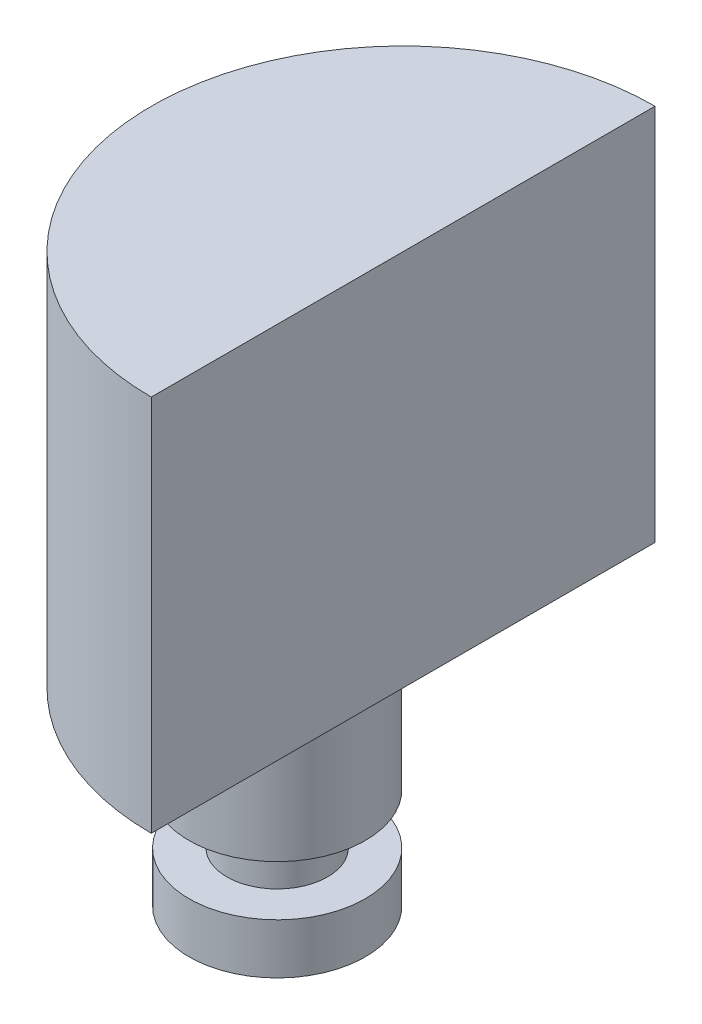
from build123d import *

# Parameters (mm, degrees)
SALIENTE_EXTRUIR1_DEPTH = 15
CROQUIS3_R              = 3.5
SALIENTE_EXTRUIR2_DEPTH = 6
CROQUIS5_R              = 2
SALIENTE_EXTRUIR4_DEPTH = 2
CROQUIS7_R              = 3.5
SALIENTE_EXTRUIR5_DEPTH = 2


with BuildPart() as part:
    # Croquis2 → Saliente-Extruir1 (new body)
    with BuildSketch(Plane(origin=(0, 0, 0), x_dir=(1, 0, 0), z_dir=(0, 1, 0))):
        with BuildLine():
            Line((0, 10), (0, -10))
            ThreePointArc((0, -10), (-10, 0), (0, 10))
        make_face()
    extrude(amount=SALIENTE_EXTRUIR1_DEPTH)

    # Croquis3 → Saliente-Extruir2 (add)
    with BuildSketch(Plane.XZ):
        with Locations(Location((-5, 0, 0), (0, 0, 270))):
            Circle(CROQUIS3_R)
    extrude(amount=SALIENTE_EXTRUIR2_DEPTH)

    # Croquis5 → Saliente-Extruir4 (add)
    with BuildSketch(Plane.XZ.offset(6)):
        with Locations(Location((-5, 0, 0), (0, 0, 270))):
            Circle(CROQUIS5_R)
    extrude(amount=SALIENTE_EXTRUIR4_DEPTH)

    # Croquis7 → Saliente-Extruir5 (add)
    with BuildSketch(Plane.XZ.offset(8)):
        with Locations(Location((-5, 0, 0), (0, 0, 270))):
            Circle(CROQUIS7_R)
    extrude(amount=SALIENTE_EXTRUIR5_DEPTH)


solid = part.part
